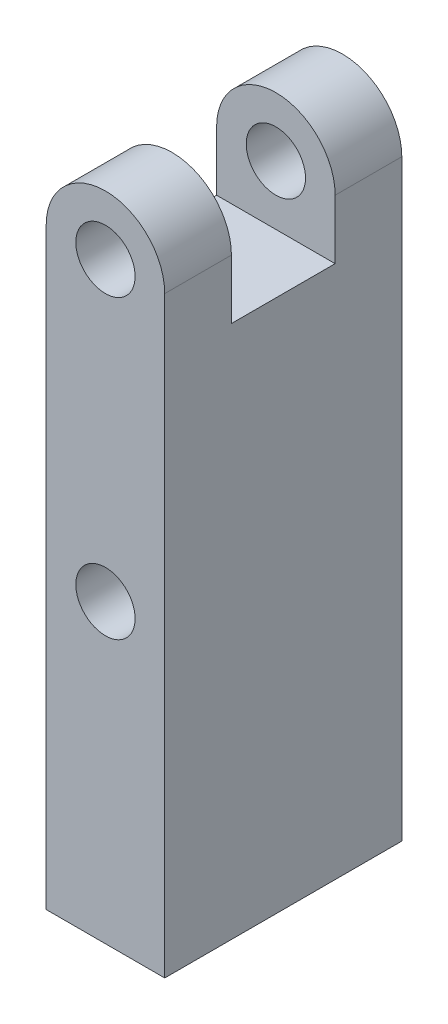
from build123d import *

# Parameters (mm, degrees)
SKETCH_1_R               = 0.5
EXTRUDE_1_DEPTH          = 4
CUT_EXTRUDE_1_DEPTH      = 8.679442038
CUT_EXTRUDE_1_DEPTH_BACK = 8.679442038


with BuildPart() as part:
    # 草图1 → 凸台-拉伸1 (new body)
    with BuildSketch(Plane.XY):
        with BuildLine():
            Line((-1.244261308, -4.563724383), (-1.244261308, 5.436275617))
            ThreePointArc((-1.244261308, 5.436275617), (-0.244261308, 6.436275617), (0.755738692, 5.436275617))
            Line((0.755738692, 5.436275617), (0.755738692, -4.563724383))
            Line((0.755738692, -4.563724383), (-1.244261308, -4.563724383))
        make_face()
        with Locations((-0.244261308, 5.436275617)):
            Circle(SKETCH_1_R, mode=Mode.SUBTRACT)
        with Locations((-0.244261308, 0.436275617)):
            Circle(SKETCH_1_R, mode=Mode.SUBTRACT)
    extrude(amount=EXTRUDE_1_DEPTH)

    # 草图4 → 切除-拉伸1 (cut, two sides: drawn at the far end of the back side and taken through both)
    with BuildSketch(Plane(origin=(0, 0, 0), x_dir=(0, 0, -1), z_dir=(1, 0, 0)).offset(-CUT_EXTRUDE_1_DEPTH_BACK)):
        Polygon((-2.875, 39.17528395), (-2.875, 6.436275617), (-2.875, 4.436275617), (-1.125, 4.436275617), (-1.125, 6.436275617), (-1.125, 39.17528395), (-1.125, 104.653300618), (-2.875, 104.653300618), align=None)
    extrude(amount=CUT_EXTRUDE_1_DEPTH + CUT_EXTRUDE_1_DEPTH_BACK, mode=Mode.SUBTRACT)


solid = part.part
